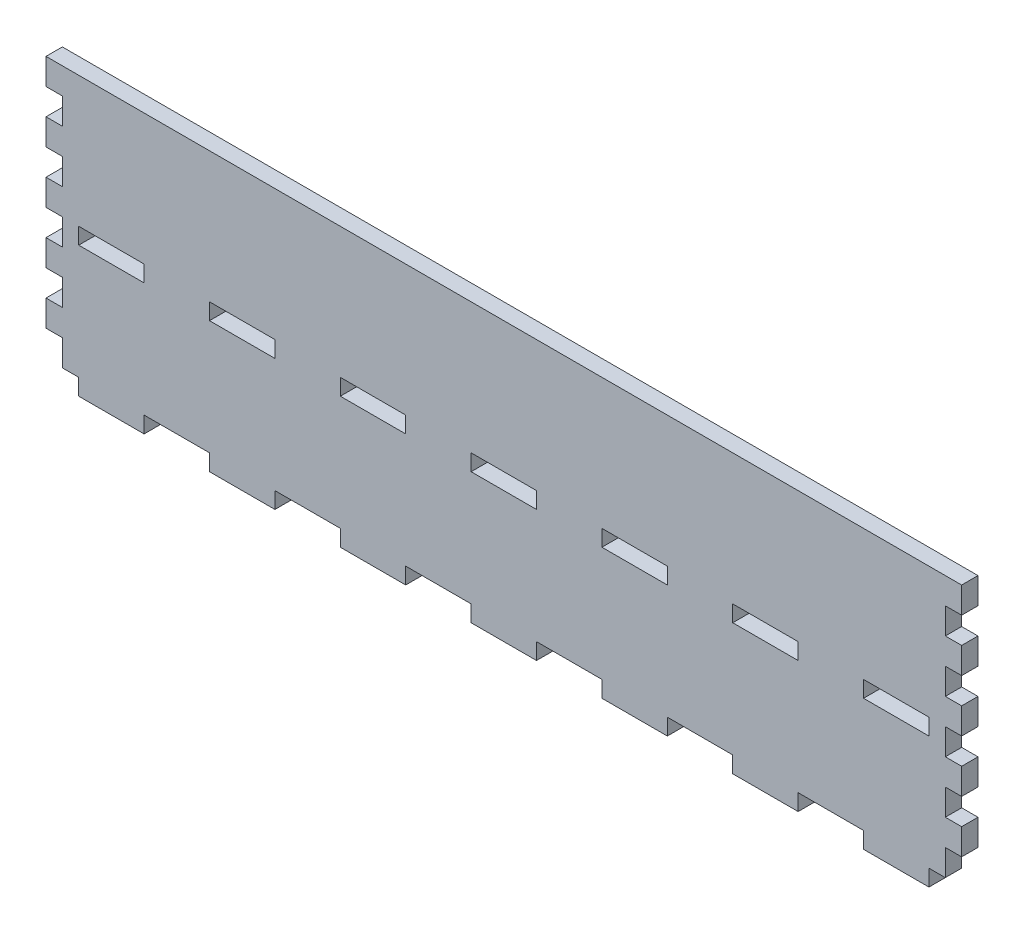
from build123d import *

# Parameters (mm, degrees)
ESQUISSE1_W                     = 355.6
ESQUISSE1_H                     = 107.95
BOSS_EXTRU_1_DEPTH              = 6.35
ESQUISSE4_W                     = 6.35
ESQUISSE4_H                     = 10.16
ENL_V_MAT_EXTRU_3_DEPTH         = 6.35
R_P_TITION_LIN_AIRE2_COUNT      = 5
R_P_TITION_LIN_AIRE2_PITCH      = 20.32
R_P_TITION_LIN_AIRE2_COUNT_DIR2 = 2
R_P_TITION_LIN_AIRE2_PITCH_DIR2 = 349.25
ESQUISSE5_W                     = 25.4
ESQUISSE5_H                     = 6.35
ENL_V_MAT_EXTRU_4_DEPTH         = 6.35
R_P_TITION_LIN_AIRE3_COUNT      = 7
R_P_TITION_LIN_AIRE3_PITCH      = 50.8
ESQUISSE6_W                     = 12.7
ESQUISSE6_H                     = 6.35
ENL_V_MAT_EXTRU_5_DEPTH         = 6.35
ESQUISSE7_W                     = 25.4
ESQUISSE7_H                     = 6.35
ENL_V_MAT_EXTRU_6_DEPTH         = 6.35
R_P_TITION_LIN_AIRE5_COUNT      = 7
R_P_TITION_LIN_AIRE5_PITCH      = 50.8


with BuildPart() as part:
    # Esquisse1 → Boss.-Extru.1 (new body)
    with BuildSketch(Plane.XY):
        Rectangle(ESQUISSE1_W, ESQUISSE1_H)
    extrude(amount=BOSS_EXTRU_1_DEPTH)

    # Esquisse4 → Enlèv. mat.-Extru.3 (cut)
    with BuildSketch(Plane.XY.offset(6.35)):
        with Locations((-174.625, 38.735)):
            Rectangle(ESQUISSE4_W, ESQUISSE4_H)
    enl_v_mat_extru_3 = extrude(amount=-ENL_V_MAT_EXTRU_3_DEPTH, mode=Mode.SUBTRACT)

    # Répétition linéaire2: Enl_v. mat.-Extru.3 5 × 2
    with Locations(*[(j * R_P_TITION_LIN_AIRE2_PITCH_DIR2, -i * R_P_TITION_LIN_AIRE2_PITCH, 0) for i in range(R_P_TITION_LIN_AIRE2_COUNT) for j in range(R_P_TITION_LIN_AIRE2_COUNT_DIR2) if (i, j) != (0, 0)]):
        add(enl_v_mat_extru_3, mode=Mode.SUBTRACT)

    # Esquisse5 → Enlèv. mat.-Extru.4 (cut)
    with BuildSketch(Plane.XY.offset(6.35)):
        with Locations((-127, -50.8)):
            Rectangle(ESQUISSE5_W, ESQUISSE5_H)
    enl_v_mat_extru_4 = extrude(amount=-ENL_V_MAT_EXTRU_4_DEPTH, mode=Mode.SUBTRACT)

    # Répétition linéaire3: Enlèv. mat.-Extru.4 ×7
    with Locations(*[(i * R_P_TITION_LIN_AIRE3_PITCH, 0, 0) for i in range(1, R_P_TITION_LIN_AIRE3_COUNT)]):
        add(enl_v_mat_extru_4, mode=Mode.SUBTRACT)

    # Esquisse6 → Enlèv. mat.-Extru.5 (cut)
    with BuildSketch(Plane.XY.offset(6.35)):
        with Locations((-171.45, -50.8)):
            Rectangle(ESQUISSE6_W, ESQUISSE6_H)
    extrude(amount=-ENL_V_MAT_EXTRU_5_DEPTH, mode=Mode.SUBTRACT)

    # Esquisse7 → Enlèv. mat.-Extru.6 (cut)
    with BuildSketch(Plane.XY.offset(6.35)):
        with Locations((-152.4, 0)):
            Rectangle(ESQUISSE7_W, ESQUISSE7_H)
    enl_v_mat_extru_6 = extrude(amount=-ENL_V_MAT_EXTRU_6_DEPTH, mode=Mode.SUBTRACT)

    # Répétition linéaire5: Enlèv. mat.-Extru.6 ×7
    with Locations(*[(i * R_P_TITION_LIN_AIRE5_PITCH, 0, 0) for i in range(1, R_P_TITION_LIN_AIRE5_COUNT)]):
        add(enl_v_mat_extru_6, mode=Mode.SUBTRACT)


solid = part.part
